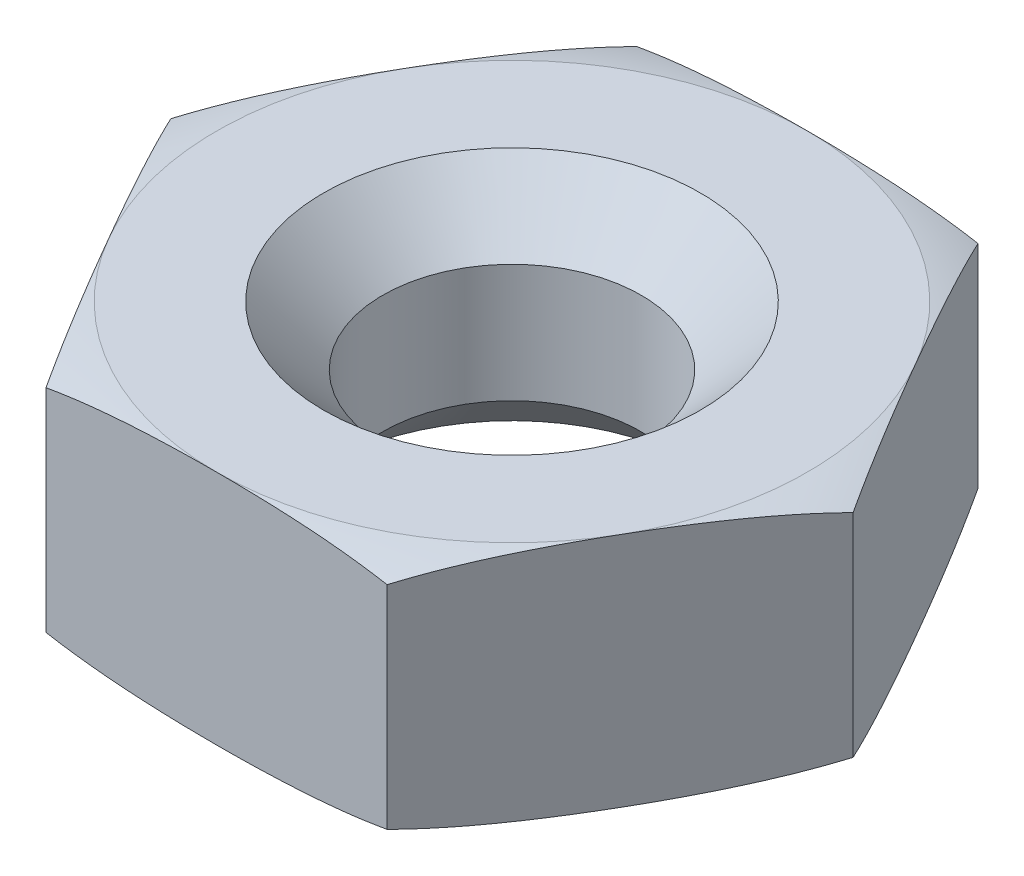
from build123d import *

# Parameters (mm, degrees)
SKETCH1_R           = 0.875
BOSS_EXTRUDE1_DEPTH = 0.8


with BuildPart() as part:
    # Sketch1 → Boss-Extrude1 (new, symmetric)
    with BuildSketch(Plane(origin=(0, 0, 0), x_dir=(1, 0, 0), z_dir=(0, 1, 0))):
        Polygon((2.309401077, 0), (1.154700538, 2), (-1.154700538, 2), (-2.309401077, 0), (-1.154700538, -2), (1.154700538, -2), align=None)
        with Locations(Location((0, 0, 0), (0, 0, 270))):
            Circle(SKETCH1_R, mode=Mode.SUBTRACT)
    extrude(amount=BOSS_EXTRUDE1_DEPTH, both=True)

    # Sketch2 → Cut-Revolve1 (revolve, cut)
    with BuildSketch(Plane(origin=(0, 0, 0), x_dir=(0, 0, -1), z_dir=(1, 0, 0))):
        with BuildLine():
            Line((-2, 0.8), (-3, 0.8))
            Line((-3, 0.8), (-3, 0.3))
            ThreePointArc((-3, 0.3), (-2.535648989, 0.621297978), (-2, 0.8))
        make_face()
        Polygon((-0.875, 0.8), (-0.875, 0.4), (-1.275, 0.8), align=None)
    cut_revolve1 = revolve(axis=Axis((0, 0.8, 0), (0, -1, 0)), mode=Mode.SUBTRACT)

    # Mirror1: Cut-Revolve1 across plane
    add(cut_revolve1.mirror(Plane.ZX), mode=Mode.SUBTRACT)


solid = part.part
